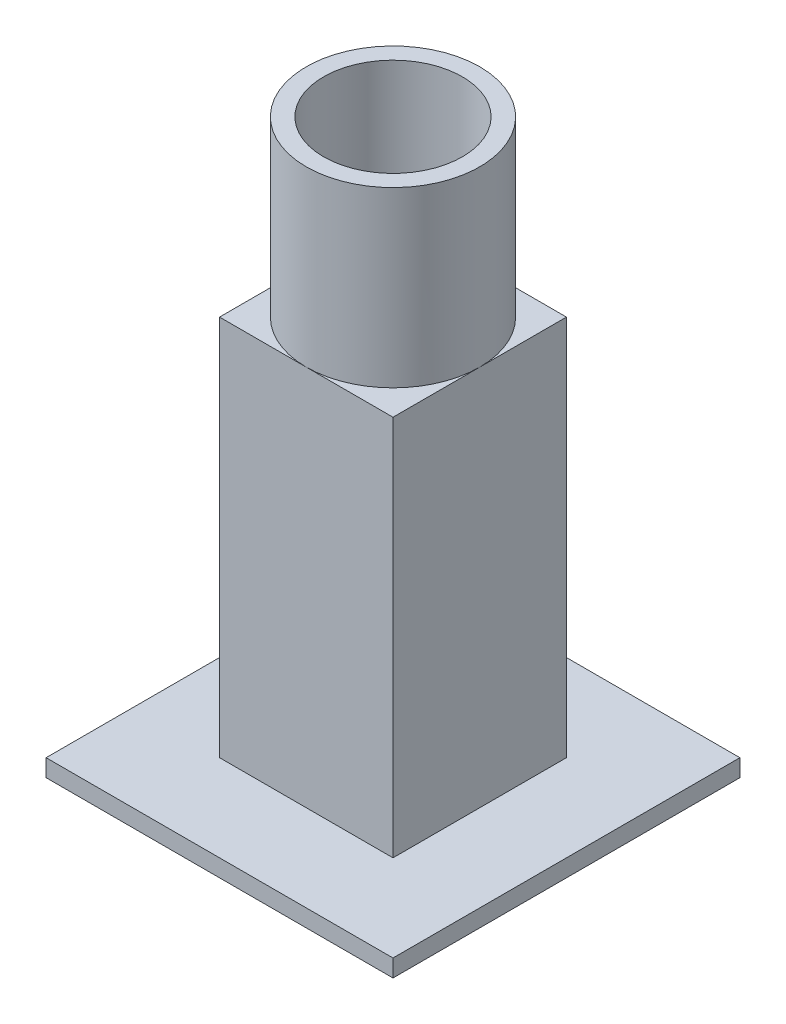
from build123d import *

# Parameters (mm, degrees)
SKETCH1_W           = 200
SKETCH1_H           = 200
BOSS_EXTRUDE1_DEPTH = 10
SKETCH2_W           = 100
SKETCH2_H           = 100
SKETCH2_R           = 40
BOSS_EXTRUDE2_DEPTH = 220
SKETCH3_R           = 50
SKETCH3_R_2         = 40
BOSS_EXTRUDE3_DEPTH = 100


with BuildPart() as part:
    # Sketch1 → Boss-Extrude1 (new body)
    with BuildSketch(Plane(origin=(0, 0, 0), x_dir=(1, 0, 0), z_dir=(0, 1, 0))):
        with Locations((100, 100)):
            Rectangle(SKETCH1_W, SKETCH1_H)
    extrude(amount=BOSS_EXTRUDE1_DEPTH)

    # Sketch2 → Boss-Extrude2 (add)
    with BuildSketch(Plane(origin=(0, 10, 0), x_dir=(1, 0, 0), z_dir=(0, 1, 0))):
        with Locations((100, 100)):
            Rectangle(SKETCH2_W, SKETCH2_H)
        with Locations(Location((100, 100, 0), (0, 0, 270))):
            Circle(SKETCH2_R, mode=Mode.SUBTRACT)
    extrude(amount=BOSS_EXTRUDE2_DEPTH)

    # Sketch3 → Boss-Extrude3 (add)
    with BuildSketch(Plane(origin=(0, 230, 0), x_dir=(1, 0, 0), z_dir=(0, 1, 0))):
        with Locations(Location((100, 100, 0), (0, 0, 270))):
            Circle(SKETCH3_R)
        with Locations(Location((100, 100, 0), (0, 0, 270))):
            Circle(SKETCH3_R_2, mode=Mode.SUBTRACT)
    extrude(amount=BOSS_EXTRUDE3_DEPTH)


solid = part.part
